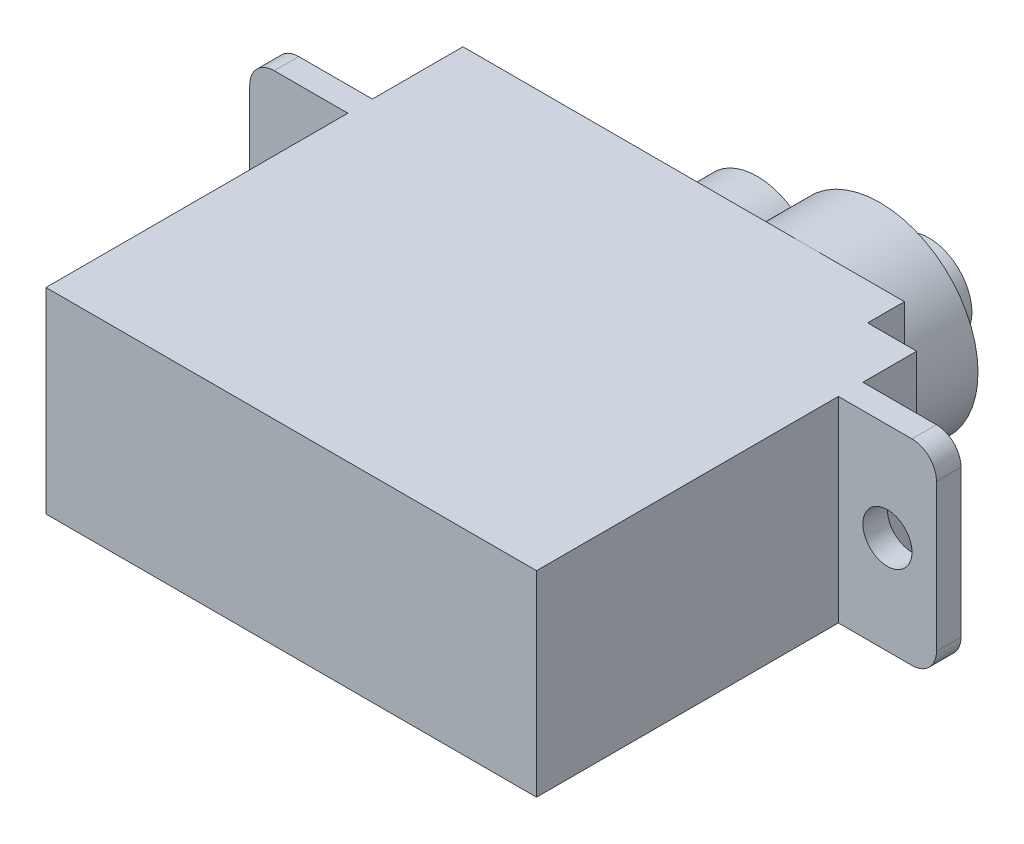
from build123d import *

# Parameters (mm, degrees)
SKETCH1_W           = 4
SKETCH1_H           = 1
BOSS_EXTRUDE3_DEPTH = 8
SKETCH2_R           = 4
BOSS_EXTRUDE5_DEPTH = 3
SKETCH3_R           = 2.5
BOSS_EXTRUDE6_DEPTH = 3
SKETCH4_R           = 1
CUT_EXTRUDE1_DEPTH  = 23.259998772
FILLET2_R           = 1
FILLET3_R           = 1
SKETCH6_R           = 1.75
BOSS_EXTRUDE8_DEPTH = 2


with BuildPart() as part:
    # Sketch1 → Boss-Extrude3 (new body)
    with BuildSketch(Plane(origin=(0, 0, 0), x_dir=(1, 0, 0), z_dir=(0, 1, 0))):
        Polygon((9.951219512, 4.301393728), (9.951219512, 5.801393728), (-8.048780488, 5.801393728), (-8.048780488, -11.198606272), (11.951219512, -11.198606272), (11.951219512, 4.301393728), align=None)
        with Locations((13.951219512, 1.608013937)):
            Rectangle(SKETCH1_W, SKETCH1_H)
        with Locations((-10.048780488, 1.608013937)):
            Rectangle(SKETCH1_W, SKETCH1_H)
    extrude(amount=BOSS_EXTRUDE3_DEPTH)

    # Sketch2 → Boss-Extrude5 (add)
    with BuildSketch(Plane(origin=(0, 0, -5.801393728), x_dir=(-1, 0, 0), z_dir=(0, 0, -1))):
        with Locations(Location((-5.951219512, 4, 0), (0, 0, 180))):
            Circle(SKETCH2_R)
    extrude(amount=BOSS_EXTRUDE5_DEPTH)

    # Sketch3 → Boss-Extrude6 (add)
    with BuildSketch(Plane(origin=(0, 0, -5.801393728), x_dir=(-1, 0, 0), z_dir=(0, 0, -1))):
        with Locations((-0.951219512, 3.925831124)):
            Circle(SKETCH3_R)
    extrude(amount=BOSS_EXTRUDE6_DEPTH)

    # Sketch4 → Cut-Extrude1 (cut, through all)
    with BuildSketch(Plane(origin=(0, 0, -2.108013937), x_dir=(-1, 0, 0), z_dir=(0, 0, -1))):
        with Locations((-13.951219512, 4)):
            Circle(SKETCH4_R)
        with Locations((10.048780488, 4)):
            Circle(SKETCH4_R)
    extrude(amount=-CUT_EXTRUDE1_DEPTH, mode=Mode.SUBTRACT)

    # Fillet2
    fillet2_edges = [part.edges().sort_by_distance(p)[0] for p in [
        (15.951219512, 8, -1.608013937),
    ]]
    fillet(fillet2_edges, radius=FILLET2_R)

    # Fillet3
    fillet3_edges = [part.edges().sort_by_distance(p)[0] for p in [
        (15.951219512, 0, -1.608013937),
        (-12.048780488, 8, -1.608013937),
        (-12.048780488, 0, -1.608013937),
    ]]
    fillet(fillet3_edges, radius=FILLET3_R)

    # Sketch6 → Boss-Extrude8 (add)
    with BuildSketch(Plane(origin=(0, 0, -8.801393728), x_dir=(-1, 0, 0), z_dir=(0, 0, -1))):
        with Locations((-5.951219512, 4)):
            Circle(SKETCH6_R)
    extrude(amount=BOSS_EXTRUDE8_DEPTH)


solid = part.part
